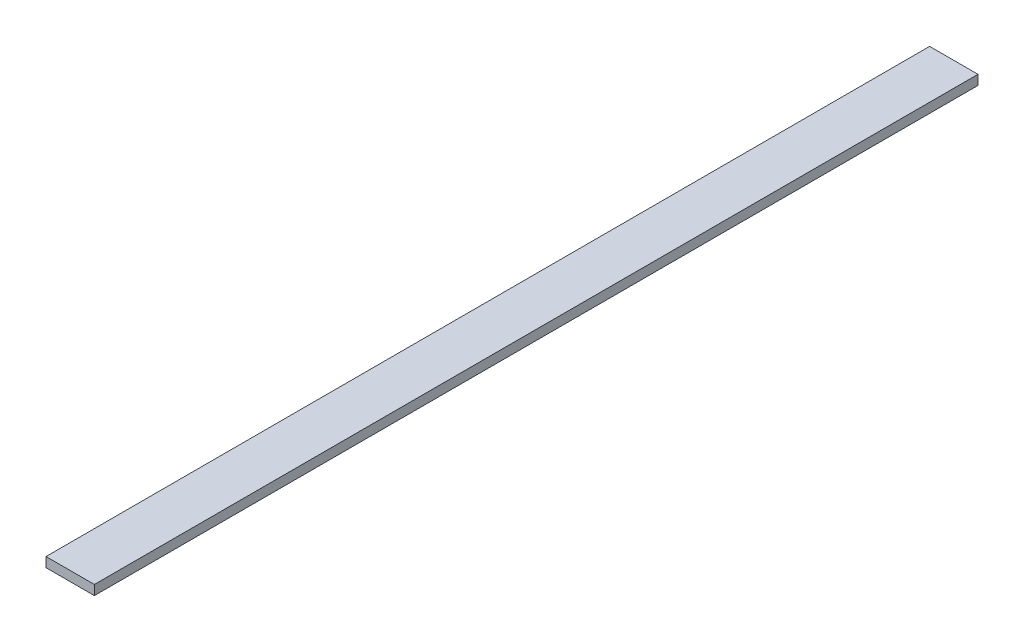
from build123d import *

# Parameters (mm, degrees)
SKETCH1_W           = 10
SKETCH1_H           = 182.647861204
BOSS_EXTRUDE1_DEPTH = 2


with BuildPart() as part:
    # Sketch1 → Boss-Extrude1 (new body)
    with BuildSketch(Plane(origin=(0, 0, 0), x_dir=(1, 0, 0), z_dir=(0, 1, 0))):
        with Locations((-5, 0)):
            Rectangle(SKETCH1_W, SKETCH1_H)
    extrude(amount=BOSS_EXTRUDE1_DEPTH)


solid = part.part
